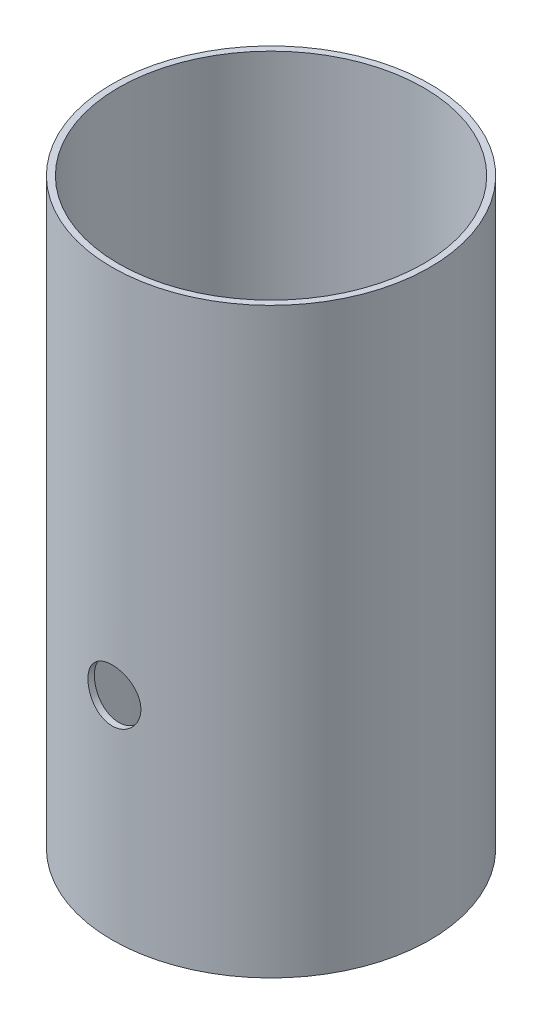
from build123d import *

# Parameters (mm, degrees)
SKETCH_1_R         = 38.1
SKETCH_1_R_2       = 36.576
EXTRUDE_1_DEPTH    = 69.85
SKETCH1_R          = 6.35
CUT_EXTRUDE1_DEPTH = 89.217019333
CIRPATTERN1_COUNT  = 2
CIRPATTERN1_ANGLE  = 90


with BuildPart() as part:
    # 草图1 → 凸台-拉伸1 (new, symmetric)
    with BuildSketch(Plane(origin=(0, 0, 0), x_dir=(1, 0, 0), z_dir=(0, 1, 0))):
        with Locations(Location((0, 0, 0), (0, 0, 270))):
            Circle(SKETCH_1_R)
        with Locations(Location((0, 0, 0), (0, 0, 270))):
            Circle(SKETCH_1_R_2, mode=Mode.SUBTRACT)
    extrude(amount=EXTRUDE_1_DEPTH, both=True)

    # Sketch1 → Cut-Extrude1 (cut, through all)
    with BuildSketch(Plane(origin=(0, 0, 0), x_dir=(0, 0, -1), z_dir=(1, 0, 0))):
        with Locations((0, -19.05)):
            Circle(SKETCH1_R)
    cut_extrude1 = extrude(amount=-CUT_EXTRUDE1_DEPTH, mode=Mode.SUBTRACT)

    # CirPattern1: Cut-Extrude1 ×2 about axis
    cirpattern1_axis = Axis((0, -69.85, 0), (0, 1, 0))
    for i in range(1, CIRPATTERN1_COUNT):
        add(cut_extrude1.rotate(cirpattern1_axis, i * CIRPATTERN1_ANGLE / (CIRPATTERN1_COUNT - 1)), mode=Mode.SUBTRACT)


solid = part.part
